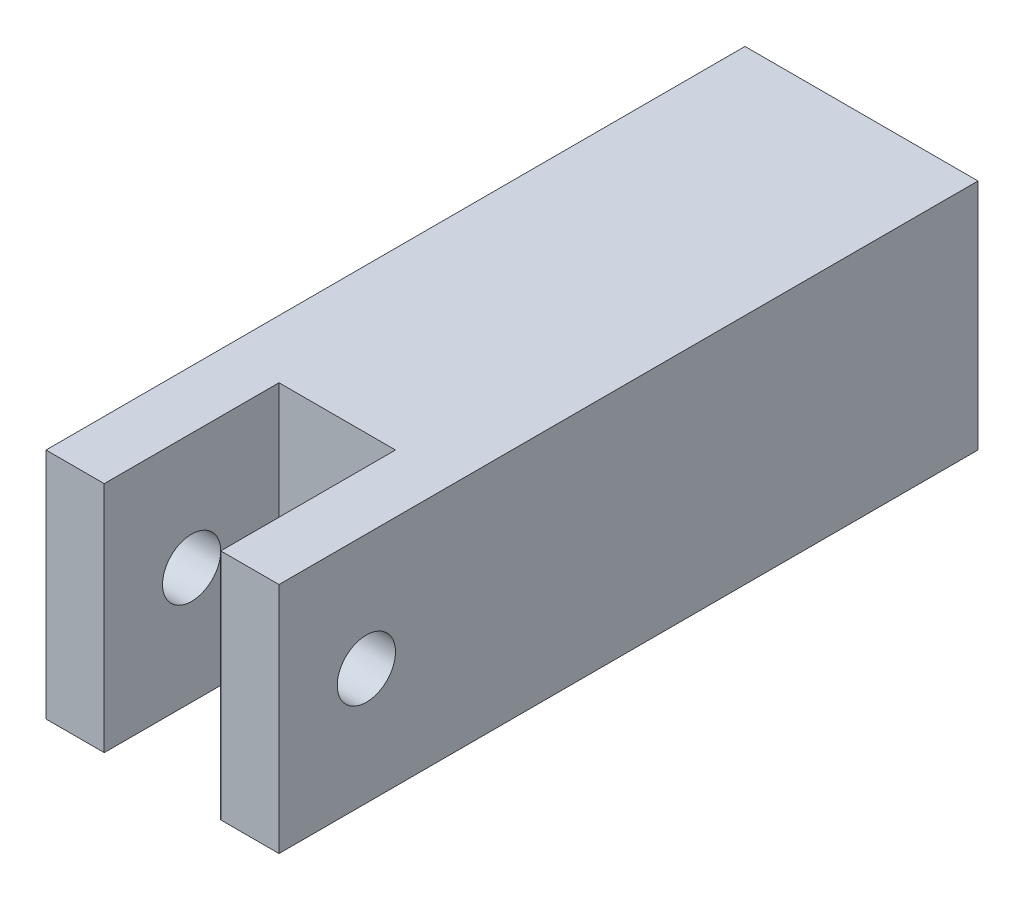
from build123d import *

# Parameters (mm, degrees)
SKICA1_W                 = 40
SKICA1_H                 = 40
P_IDAT_VYSUNUT_M1_DEPTH  = 90
SKICA3_W                 = 10
SKICA3_H                 = 40
P_IDAT_VYSUNUT_M2_DEPTH  = 30
SKICA4_R                 = 5
ODEBRAT_VYSUNUT_M1_DEPTH = 40
SKICA5_R                 = 2.5
ODEBRAT_VYSUNUT_M2_DEPTH = 10


with BuildPart() as part:
    # Skica1 → Přidat vysunutím1 (new body)
    with BuildSketch(Plane.XY):
        Rectangle(SKICA1_W, SKICA1_H)
    extrude(amount=P_IDAT_VYSUNUT_M1_DEPTH)

    # Skica3 → Přidat vysunutím2 (add)
    with BuildSketch(Plane.XY.offset(90)):
        with Locations((15, 0)):
            Rectangle(SKICA3_W, SKICA3_H)
        with Locations((-15, 0)):
            Rectangle(SKICA3_W, SKICA3_H)
    extrude(amount=P_IDAT_VYSUNUT_M2_DEPTH)

    # Skica4 → Odebrat vysunutím1 (cut)
    with BuildSketch(Plane.ZY.offset(20)):
        with Locations(Location((105, 0, 0), (0, 0, 270))):
            Circle(SKICA4_R)
    extrude(amount=-ODEBRAT_VYSUNUT_M1_DEPTH, mode=Mode.SUBTRACT)

    # Skica5 → Odebrat vysunutím2 (cut)
    with BuildSketch(Plane(origin=(0, 0, 0), x_dir=(-1, 0, 0), z_dir=(0, 0, -1))):
        Circle(SKICA5_R)
    extrude(amount=-ODEBRAT_VYSUNUT_M2_DEPTH, mode=Mode.SUBTRACT)


solid = part.part
